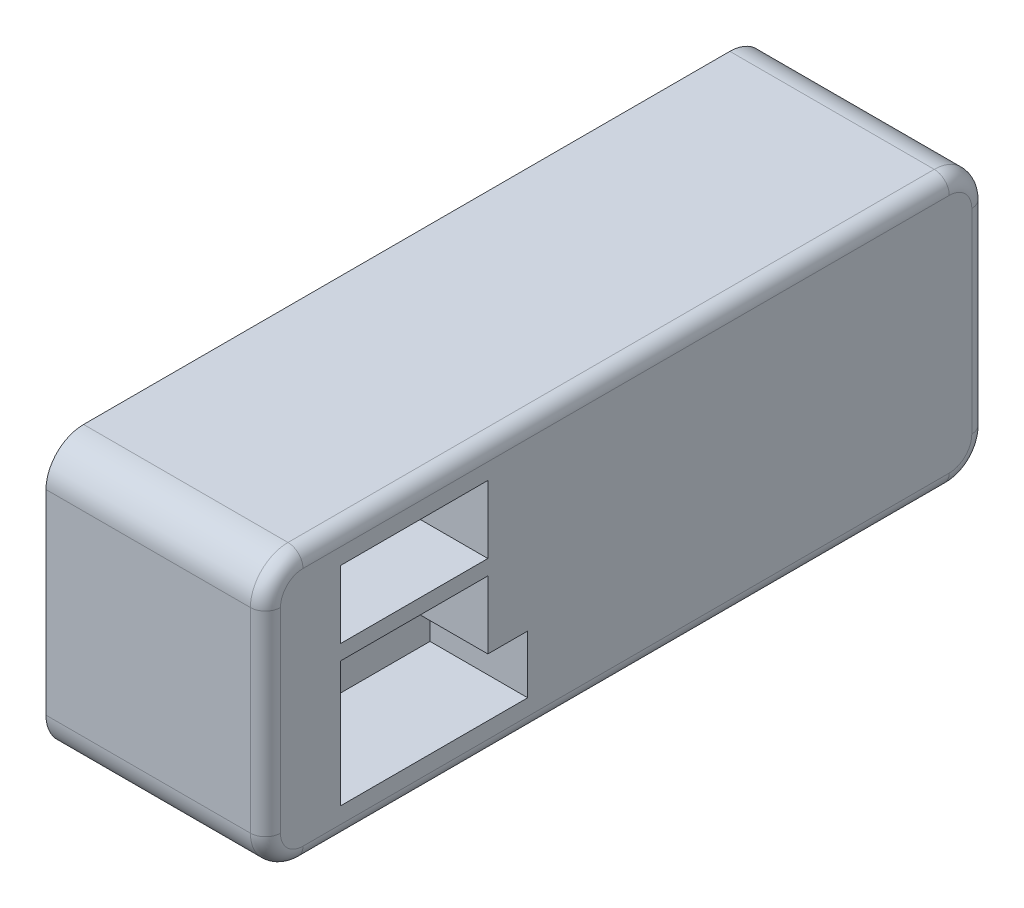
from build123d import *

# Parameters (mm, degrees)
EXTRUDE_1_DEPTH     = 14.6
FILLET_1_R          = 1
CUT_EXTRUDE_1_DEPTH = 8
CHAMFER_1_SIZE      = 0.5
SKETCH_3_W          = 9.8
SKETCH_3_H          = 4.5
CUT_EXTRUDE_2_DEPTH = 6.5


with BuildPart() as part:
    # ｽｹｯﾁ1 → ﾎﾞｽ - 押し出し1 (new body)
    with BuildSketch(Plane(origin=(0, 0, 0), x_dir=(0, 0, -1), z_dir=(1, 0, 0))):
        with BuildLine():
            Line((-21.5, 9), (21.5, 9))
            ThreePointArc((21.5, 9), (23.267766953, 8.267766953), (24, 6.5))
            Line((24, 6.5), (24, -6.5))
            ThreePointArc((24, -6.5), (23.267766953, -8.267766953), (21.5, -9))
            Line((21.5, -9), (-21.5, -9))
            ThreePointArc((-21.5, -9), (-23.267766953, -8.267766953), (-24, -6.5))
            Line((-24, -6.5), (-24, 6.5))
            ThreePointArc((-24, 6.5), (-23.267766953, 8.267766953), (-21.5, 9))
        make_face()
    extrude(amount=EXTRUDE_1_DEPTH)

    # ﾌｨﾚｯﾄ1
    fillet_1_edges = [part.edges().sort_by_distance(p)[0] for p in [
        (14.6, 8.267766953, 23.267766953),
        (14.6, 0, 24),
        (14.6, -8.267766953, 23.267766953),
        (14.6, -9, 0),
        (14.6, -8.267766953, -23.267766953),
        (14.6, 0, -24),
        (14.6, 8.267766953, -23.267766953),
        (14.6, 9, 0),
    ]]
    fillet(fillet_1_edges, radius=FILLET_1_R)

    # ｽｹｯﾁ2 → ｶｯﾄ - 押し出し1 (cut)
    with BuildSketch(Plane(origin=(0, 0, -24), x_dir=(-1, 0, 0), z_dir=(0, 0, -1))):
        with BuildLine():
            Line((-9.15, 3.433012702), (-8.25, 2.91339746))
            ThreePointArc((-8.25, 2.91339746), (-8.066987298, 2.730384758), (-8, 2.480384758))
            Line((-8, 2.480384758), (-8, -2.480384758))
            ThreePointArc((-8, -2.480384758), (-8.066987298, -2.730384758), (-8.25, -2.91339746))
            Line((-8.25, -2.91339746), (-9.15, -3.433012702))
            ThreePointArc((-9.15, -3.433012702), (-9.65, -3.433012702), (-9.9, -3))
            Line((-9.9, -3), (-9.9, 3))
            ThreePointArc((-9.9, 3), (-9.65, 3.433012702), (-9.15, 3.433012702))
        make_face()
    extrude(amount=-CUT_EXTRUDE_1_DEPTH, mode=Mode.SUBTRACT)

    # 面取り1
    chamfer_1_edges = [part.edges().sort_by_distance(p)[0] for p in [
        (8.066987298, -2.730384758, -24),
        (8, 0, -24),
        (8.066987298, 2.730384758, -24),
        (8.7, 3.173205081, -24),
        (9.65, 3.433012702, -24),
        (9.9, 0, -24),
        (9.65, -3.433012702, -24),
        (8.7, -3.173205081, -24),
    ]]
    chamfer(chamfer_1_edges, length=CHAMFER_1_SIZE)

    # ｽｹｯﾁ3 → ｶｯﾄ - 押し出し2 (cut)
    with BuildSketch(Plane(origin=(14.6, 0, 0), x_dir=(0, 0, -1), z_dir=(1, 0, 0))):
        Polygon((-19, 1.425), (-19, -6.925), (-6.55, -6.925), (-6.55, -3.075), (-9.2, -3.075), (-9.2, 1.425), align=None)
        with Locations((-14.1, 4.675)):
            Rectangle(SKETCH_3_W, SKETCH_3_H)
    extrude(amount=-CUT_EXTRUDE_2_DEPTH, mode=Mode.SUBTRACT)


solid = part.part
